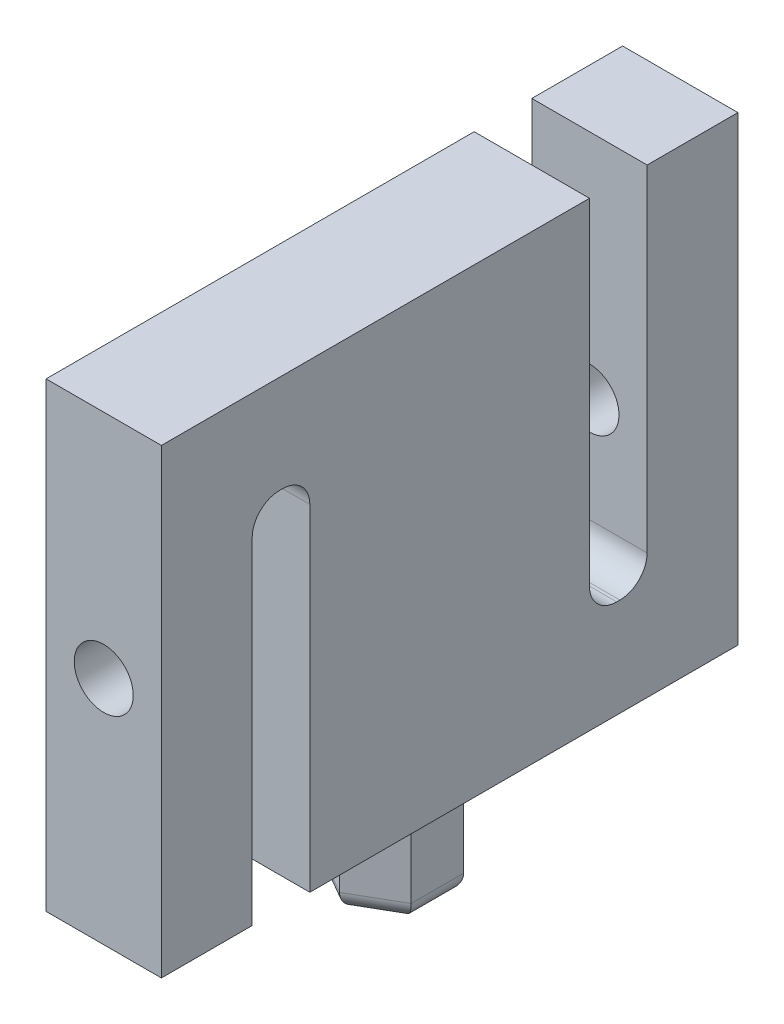
from build123d import *

# Parameters (mm, degrees)
BOSS_EXTRUDE1_DEPTH = 6.35
FILLET1_R           = 3
CUT_EXTRUDE1_REACH  = 313.409
SKETCH2_R           = 3.25
BOSS_EXTRUDE2_DEPTH = 10
FILLET2_R           = 2


with BuildPart() as part:
    # Sketch1 → Boss-Extrude1 (new, symmetric)
    with BuildSketch(Plane(origin=(0, 0, 0), x_dir=(0, 0, -1), z_dir=(1, 0, 0))):
        Polygon((-54.45, 304.8), (-54.45, 264.8), (-60.8, 264.8), (-60.8, 304.8), (-107.95, 304.8), (-107.95, 254), (-97.95, 254), (-97.95, 294), (-91.6, 294), (-91.6, 254), (-44.45, 254), (-44.45, 304.8), align=None)
    extrude(amount=BOSS_EXTRUDE1_DEPTH, both=True)

    # Fillet1
    fillet1_edges = [part.edges().sort_by_distance(p)[0] for p in [
        (0, 264.8, 54.45),
        (0, 294, 91.6),
        (0, 294, 97.95),
        (0, 264.8, 60.8),
    ]]
    fillet(fillet1_edges, radius=FILLET1_R)

    # Sketch2 → Cut-Extrude1 (cut, up to next)
    with BuildSketch(Plane(origin=(0, 0, 44.45), x_dir=(-1, 0, 0), z_dir=(0, 0, -1)), mode=Mode.PRIVATE) as cut_extrude1_sk1:
        with Locations(Location((0, 279.4, 0), (0, 0, 90))):
            Circle(SKETCH2_R)
    cut_extrude1_tool1 = extrude(cut_extrude1_sk1.sketch, amount=-CUT_EXTRUDE1_REACH, mode=Mode.PRIVATE) & part.part
    cut_extrude1 = cut_extrude1_tool1.solids().sort_by_distance((0, 279.4, 44.45))[0]
    add(cut_extrude1, mode=Mode.SUBTRACT)

    # Mirror2: Cut-Extrude1 across plane
    add(cut_extrude1.mirror(Plane(origin=(0, 0, 76.2), x_dir=(1, 0, 0), z_dir=(0, 0, -1))), mode=Mode.SUBTRACT)


with BuildPart() as body_2:
    # Sketch8 → Boss-Extrude2 (new body)
    with BuildSketch(Plane.XZ.offset(-254)):
        Polygon((5, 73.313248654), (5, 79.086751346), (0, 81.973502692), (-5, 79.086751346), (-5, 73.313248654), (0, 70.426497308), align=None)
    extrude(amount=BOSS_EXTRUDE2_DEPTH)

    # Fillet2
    fillet2_edges = [body_2.edges().sort_by_distance(p)[0] for p in [
        (2.5, 244, 80.530127019),
        (-2.5, 244, 80.530127019),
        (-5, 244, 76.2),
        (-2.5, 244, 71.869872981),
        (2.5, 244, 71.869872981),
        (5, 244, 76.2),
    ]]
    fillet(fillet2_edges, radius=FILLET2_R)


solid = Compound([part.part, body_2.part])
